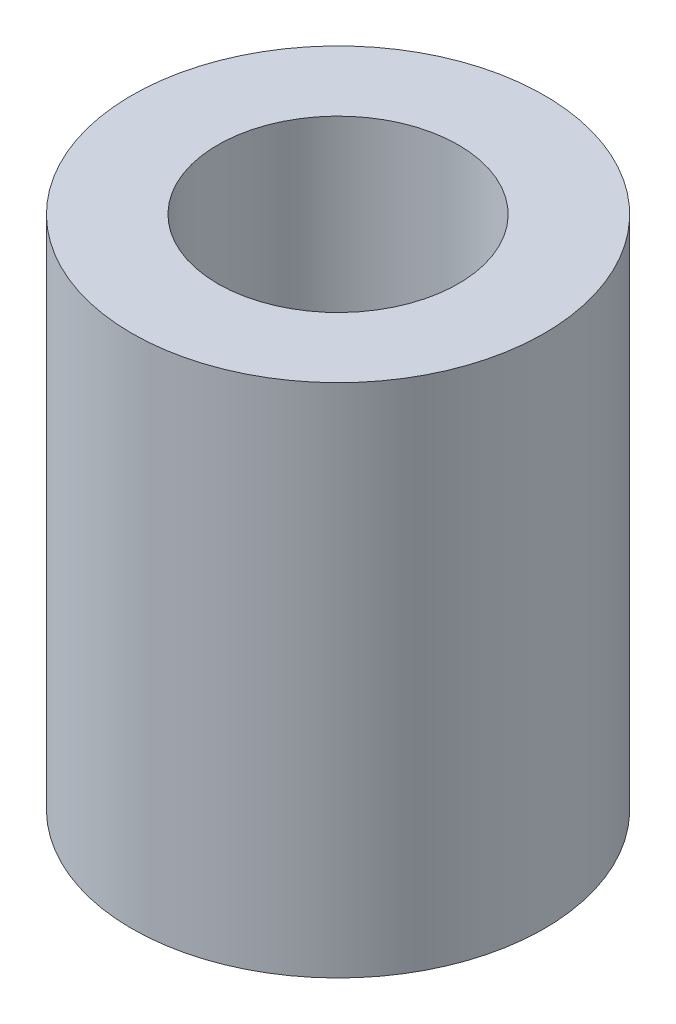
from build123d import *

# Parameters (mm, degrees)
SKETCH1_R           = 6
SKETCH1_R_2         = 3.5
BOSS_EXTRUDE1_DEPTH = 15


with BuildPart() as part:
    # Sketch1 → Boss-Extrude1 (new body)
    with BuildSketch(Plane(origin=(0, 0, 0), x_dir=(1, 0, 0), z_dir=(0, 1, 0))):
        with Locations(Location((0, 0, 0), (0, 0, 270))):
            Circle(SKETCH1_R)
        with Locations(Location((0, 0, 0), (0, 0, 270))):
            Circle(SKETCH1_R_2, mode=Mode.SUBTRACT)
    extrude(amount=BOSS_EXTRUDE1_DEPTH)


solid = part.part
